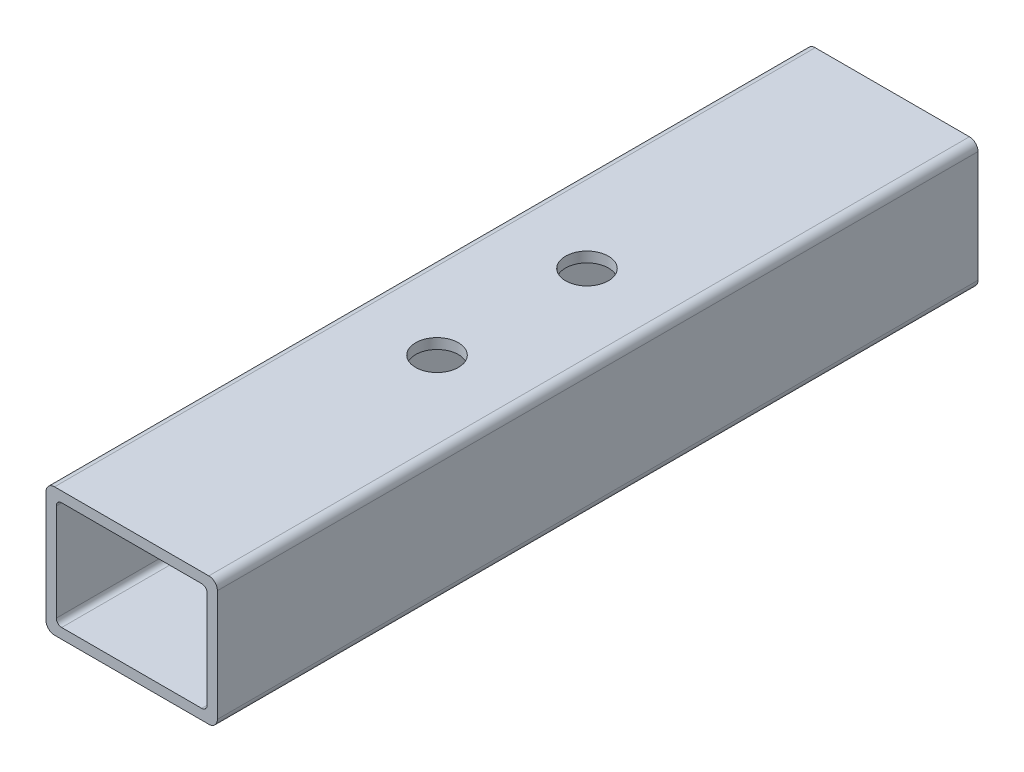
from build123d import *

# Parameters (mm, degrees)
BOSS_EXTRUDE1_DEPTH = 225.425
SKETCH9_R           = 6.35
CUT_EXTRUDE2_DEPTH  = 3.048


with BuildPart() as part:
    # Sketch4 → Boss-Extrude1 (new body)
    with BuildSketch(Plane.XY):
        with BuildLine():
            Line((25.4, -16.51), (25.4, 16.51))
            ThreePointArc((25.4, 16.51), (24.656051224, 18.306051224), (22.86, 19.05))
            Line((22.86, 19.05), (-22.86, 19.05))
            ThreePointArc((-22.86, 19.05), (-24.656051224, 18.306051224), (-25.4, 16.51))
            Line((-25.4, 16.51), (-25.4, -16.51))
            ThreePointArc((-25.4, -16.51), (-24.656051224, -18.306051224), (-22.86, -19.05))
            Line((-22.86, -19.05), (22.86, -19.05))
            ThreePointArc((22.86, -19.05), (24.656051224, -18.306051224), (25.4, -16.51))
        make_face()
        with BuildLine():
            Line((22.352, 14.4018), (22.352, -14.4018))
            ThreePointArc((22.352, -14.4018), (21.883312271, -15.533312271), (20.7518, -16.002))
            Line((20.7518, -16.002), (-20.7518, -16.002))
            ThreePointArc((-20.7518, -16.002), (-21.883312271, -15.533312271), (-22.352, -14.4018))
            Line((-22.352, -14.4018), (-22.352, 14.4018))
            ThreePointArc((-22.352, 14.4018), (-21.883312271, 15.533312271), (-20.7518, 16.002))
            Line((-20.7518, 16.002), (20.7518, 16.002))
            ThreePointArc((20.7518, 16.002), (21.883312271, 15.533312271), (22.352, 14.4018))
        make_face(mode=Mode.SUBTRACT)
    extrude(amount=BOSS_EXTRUDE1_DEPTH)

    # Sketch9 → Cut-Extrude2 (cut)
    with BuildSketch(Plane(origin=(0, 19.05, 0), x_dir=(1, 0, 0), z_dir=(0, 1, 0))):
        with Locations(Location((0, -134.9375, 0), (0, 0, 270))):
            Circle(SKETCH9_R)
        with Locations(Location((0, -90.4875, 0), (0, 0, 270))):
            Circle(SKETCH9_R)
    extrude(amount=-CUT_EXTRUDE2_DEPTH, mode=Mode.SUBTRACT)


solid = part.part
